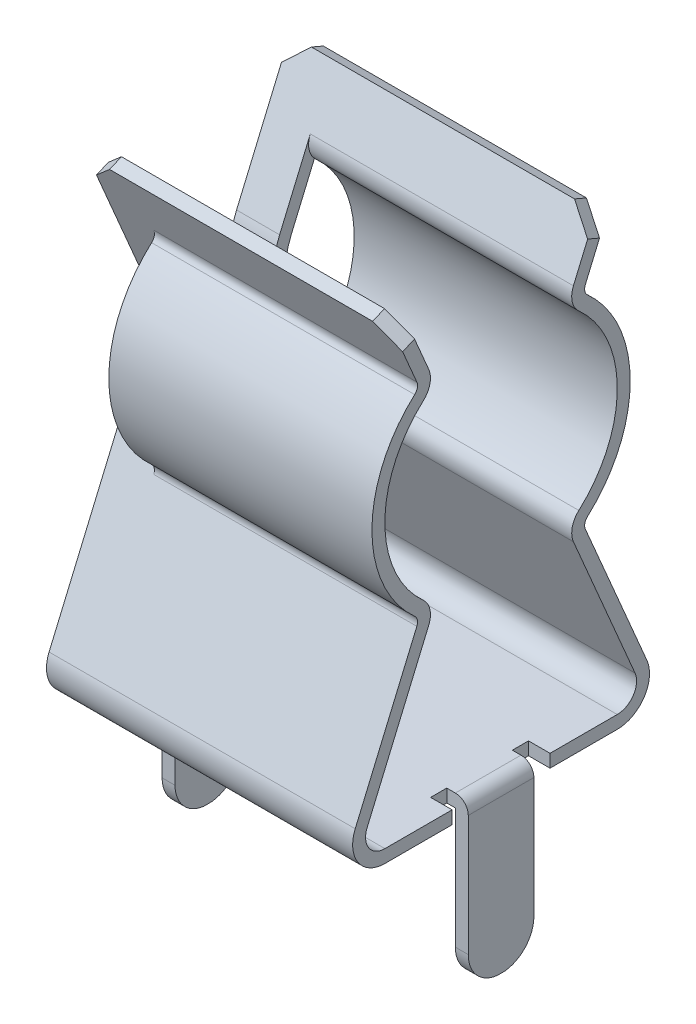
from build123d import *

# Parameters (mm, degrees)
BOSS_EXTRUDE1_DEPTH = 1
BOSS_EXTRUDE2_DEPTH = 6.112
CHAMFER1_SIZE       = 0.5
SKETCH3_W           = 0.5
SKETCH3_H           = 0.375
CUT_EXTRUDE1_DEPTH  = 0.3
SKETCH4_W           = 0.3
SKETCH4_H           = 1.524
BOSS_EXTRUDE3_DEPTH = 3.556
CUT_EXTRUDE2_DEPTH  = 14.276962233
FILLET1_R           = 0.3


with BuildPart() as part:
    # Sketch1 → Boss-Extrude1 (new body)
    with BuildSketch(Plane(origin=(0, 0, 0), x_dir=(0, 0, -1), z_dir=(1, 0, 0))):
        with BuildLine():
            Line((0, 0), (-2.698326862, 0))
            ThreePointArc((-2.698326862, 0), (-3.32408446, 0.336566295), (-3.388218281, 1.044193523))
            Line((-3.388218281, 1.044193523), (-1.243555187, 6.073483938))
            ThreePointArc((-1.243555187, 6.073483938), (-1.083265655, 6.857742795), (-1.243353466, 7.642042854))
            Line((-1.243353466, 7.642042854), (-2.482690665, 10.550393572))
            Line((-2.482690665, 10.550393572), (-2.206703839, 10.668))
            Line((-2.206703839, 10.668), (-0.96736664, 7.759649282))
            ThreePointArc((-0.96736664, 7.759649282), (-0.783265658, 6.857704215), (-0.967598619, 5.955806528))
            Line((-0.967598619, 5.955806528), (-3.112261714, 0.926516114))
            ThreePointArc((-3.112261714, 0.926516114), (-3.073781421, 0.501939777), (-2.698326862, 0.3))
            Line((-2.698326862, 0.3), (0, 0.3))
            Line((0, 0.3), (2.698326862, 0.3))
            ThreePointArc((2.698326862, 0.3), (3.073781421, 0.501939777), (3.112261714, 0.926516114))
            Line((3.112261714, 0.926516114), (0.967598619, 5.955806528))
            ThreePointArc((0.967598619, 5.955806528), (0.783265658, 6.857704215), (0.96736664, 7.759649282))
            Line((0.96736664, 7.759649282), (2.206703839, 10.668))
            Line((2.206703839, 10.668), (2.482690665, 10.550393572))
            Line((2.482690665, 10.550393572), (1.243353466, 7.642042854))
            ThreePointArc((1.243353466, 7.642042854), (1.083265655, 6.857742795), (1.243555187, 6.073483938))
            Line((1.243555187, 6.073483938), (3.388218281, 1.044193523))
            ThreePointArc((3.388218281, 1.044193523), (3.32408446, 0.336566295), (2.698326862, 0))
            Line((2.698326862, 0), (0, 0))
        make_face()
    extrude(amount=BOSS_EXTRUDE1_DEPTH)

    # Sketch2 → Boss-Extrude2 (add)
    with BuildSketch(Plane(origin=(1, 0, 0), x_dir=(0, 0, -1), z_dir=(1, 0, 0))):
        with BuildLine():
            Line((-1.956745691, 4.401033762), (-3.388218281, 1.044193523))
            ThreePointArc((-3.388218281, 1.044193523), (-3.32408446, 0.336566295), (-2.698326862, 0))
            Line((-2.698326862, 0), (2.698326862, 0))
            ThreePointArc((2.698326862, 0), (3.32408446, 0.336566295), (3.388218281, 1.044193523))
            Line((3.388218281, 1.044193523), (1.956745691, 4.401033762))
            ThreePointArc((1.956745691, 4.401033762), (1.945426233, 4.522631852), (2.006921941, 4.628142533))
            ThreePointArc((2.006921941, 4.628142533), (2.999999991, 6.858231733), (2.00657743, 9.088167487))
            ThreePointArc((2.00657743, 9.088167487), (1.94506764, 9.193658636), (1.956358041, 9.315249605))
            Line((1.956358041, 9.315249605), (2.482690665, 10.550393572))
            Line((2.482690665, 10.550393572), (2.206703839, 10.668))
            Line((2.206703839, 10.668), (1.680371215, 9.432856033))
            ThreePointArc((1.680371215, 9.432856033), (1.652145213, 9.128878611), (1.805919687, 8.865150738))
            ThreePointArc((1.805919687, 8.865150738), (2.699999992, 6.858208559), (1.806229747, 4.851128279))
            ThreePointArc((1.806229747, 4.851128279), (1.652490477, 4.587351579), (1.680789124, 4.283356353))
            Line((1.680789124, 4.283356353), (3.112261714, 0.926516114))
            ThreePointArc((3.112261714, 0.926516114), (3.073781421, 0.501939777), (2.698326862, 0.3))
            Line((2.698326862, 0.3), (-2.698326862, 0.3))
            ThreePointArc((-2.698326862, 0.3), (-3.073781421, 0.501939777), (-3.112261714, 0.926516114))
            Line((-3.112261714, 0.926516114), (-1.680789124, 4.283356353))
            ThreePointArc((-1.680789124, 4.283356353), (-1.652490477, 4.587351579), (-1.806229747, 4.851128279))
            ThreePointArc((-1.806229747, 4.851128279), (-2.699999992, 6.858208559), (-1.805919687, 8.865150738))
            ThreePointArc((-1.805919687, 8.865150738), (-1.652145213, 9.128878611), (-1.680371215, 9.432856033))
            Line((-1.680371215, 9.432856033), (-2.206703839, 10.668))
            Line((-2.206703839, 10.668), (-2.482690665, 10.550393572))
            Line((-2.482690665, 10.550393572), (-1.956358041, 9.315249605))
            ThreePointArc((-1.956358041, 9.315249605), (-1.94506764, 9.193658636), (-2.00657743, 9.088167487))
            ThreePointArc((-2.00657743, 9.088167487), (-2.999999991, 6.858231733), (-2.006921941, 4.628142533))
            ThreePointArc((-2.006921941, 4.628142533), (-1.945426233, 4.522631852), (-1.956745691, 4.401033762))
        make_face()
    extrude(amount=BOSS_EXTRUDE2_DEPTH)

    # Chamfer1
    chamfer1_edges = [part.edges().sort_by_distance(p)[0] for p in [
        (0, 10.609196786, 2.344697252),
        (0, 10.609196786, -2.344697252),
        (7.112, 10.609196786, -2.344697252),
        (7.112, 10.609196786, 2.344697252),
    ]]
    chamfer(chamfer1_edges, length=CHAMFER1_SIZE)

    # Sketch3 → Cut-Extrude1 (cut)
    with BuildSketch(Plane.XZ):
        with Locations((0.25, -0.9495)):
            Rectangle(SKETCH3_W, SKETCH3_H)
        with Locations((0.25, 0.9495)):
            Rectangle(SKETCH3_W, SKETCH3_H)
        with Locations((6.862, -0.9495)):
            Rectangle(SKETCH3_W, SKETCH3_H)
        with Locations((6.862, 0.9495)):
            Rectangle(SKETCH3_W, SKETCH3_H)
    extrude(amount=-CUT_EXTRUDE1_DEPTH, mode=Mode.SUBTRACT)

    # Sketch4 → Boss-Extrude3 (add)
    with BuildSketch(Plane.XZ):
        with Locations((0.15, 0)):
            Rectangle(SKETCH4_W, SKETCH4_H)
        with Locations((6.962, 0)):
            Rectangle(SKETCH4_W, SKETCH4_H)
    extrude(amount=BOSS_EXTRUDE3_DEPTH)

    # Sketch5 → Cut-Extrude2 (cut, through all)
    with BuildSketch(Plane.ZY):
        with BuildLine():
            ThreePointArc((-0.09968951, -3.556), (-0.572977926, -3.302883985), (-0.762, -2.80054914))
            Line((-0.762, -2.80054914), (-0.762, -3.556))
            Line((-0.762, -3.556), (-0.09968951, -3.556))
        make_face()
        with BuildLine():
            ThreePointArc((0.762, -2.80054914), (0.572977926, -3.302883985), (0.09968951, -3.556))
            Line((0.09968951, -3.556), (0.762, -3.556))
            Line((0.762, -3.556), (0.762, -2.80054914))
        make_face()
    extrude(amount=-CUT_EXTRUDE2_DEPTH, mode=Mode.SUBTRACT)

    # Fillet1
    fillet1_edges = [part.edges().sort_by_distance(p)[0] for p in [
        (0, 0.3, 0),
        (7.112, 0.3, 0),
    ]]
    fillet(fillet1_edges, radius=FILLET1_R)


solid = part.part
